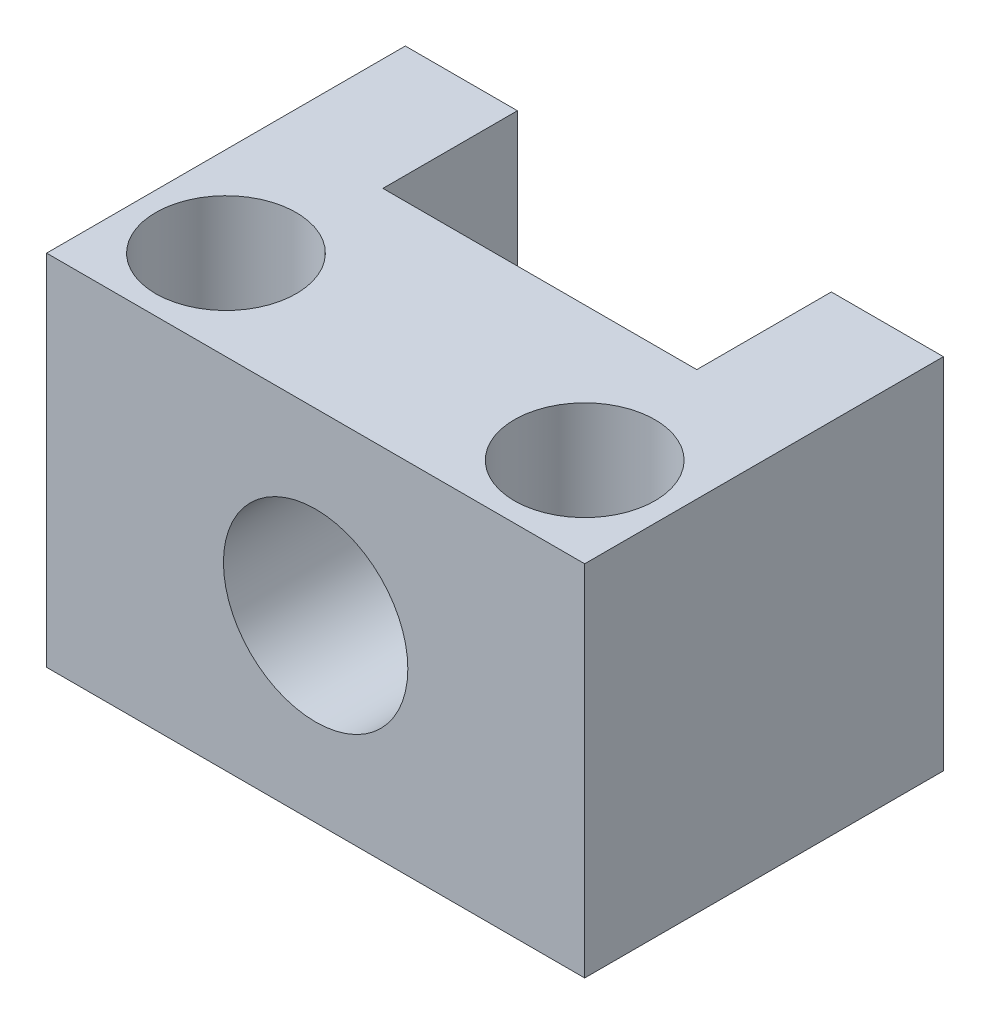
from build123d import *

# Parameters (mm, degrees)
SKETCH1_W           = 19.05
SKETCH1_H           = 12.7
BOSS_EXTRUDE1_DEPTH = 12.7
SKETCH2_R           = 2.4892
SKETCH2_W           = 11.1125
SKETCH2_H           = 4.7625
CUT_EXTRUDE1_DEPTH  = 12.7
SKETCH3_R           = 3.2639
CUT_EXTRUDE2_DEPTH  = 12.7


with BuildPart() as part:
    # Sketch1 → Boss-Extrude1 (new body)
    with BuildSketch(Plane(origin=(0, 0, 0), x_dir=(1, 0, 0), z_dir=(0, 1, 0))):
        with Locations((9.525, 6.35)):
            Rectangle(SKETCH1_W, SKETCH1_H)
    extrude(amount=BOSS_EXTRUDE1_DEPTH)

    # Sketch2 → Cut-Extrude1 (cut)
    with BuildSketch(Plane(origin=(0, 12.7, 0), x_dir=(1, 0, 0), z_dir=(0, 1, 0))):
        with Locations(Location((3.175, 3.175, 0), (0, 0, 270))):
            Circle(SKETCH2_R)
        with Locations(Location((15.875, 3.175, 0), (0, 0, 270))):
            Circle(SKETCH2_R)
        with Locations((9.525, 10.31875)):
            Rectangle(SKETCH2_W, SKETCH2_H)
    extrude(amount=-CUT_EXTRUDE1_DEPTH, mode=Mode.SUBTRACT)

    # Sketch3 → Cut-Extrude2 (cut)
    with BuildSketch(Plane.XY):
        with Locations((9.525, 6.35)):
            Circle(SKETCH3_R)
    extrude(amount=-CUT_EXTRUDE2_DEPTH, mode=Mode.SUBTRACT)


solid = part.part
